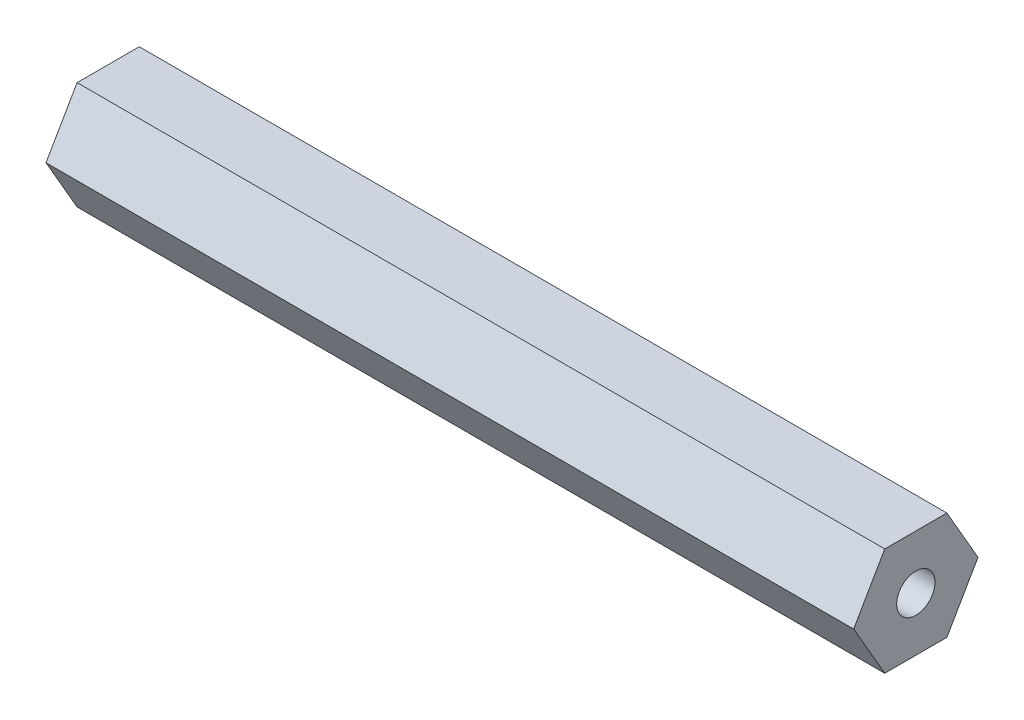
from build123d import *

# Parameters (mm, degrees)
EXTRUDE1_DEPTH            = 47.625
F_4_40_TAPPED_HOLE1_D     = 2.2606
F_4_40_TAPPED_HOLE1_DEPTH = 8.8646
F_4_40_TAPPED_HOLE1_TIP   = 0.679152758
F_4_40_TAPPED_HOLE2_D     = 2.2606
F_4_40_TAPPED_HOLE2_DEPTH = 8.8646
F_4_40_TAPPED_HOLE2_TIP   = 0.679152758


with BuildPart() as part:
    # Sketch1 → Extrude1 (new body)
    with BuildSketch(Plane(origin=(0, 0, 0), x_dir=(0, 0, -1), z_dir=(1, 0, 0))):
        Polygon((3.666174209, 0), (1.833087105, 3.175), (-1.833087105, 3.175), (-3.666174209, 0), (-1.833087105, -3.175), (1.833087105, -3.175), align=None)
    extrude(amount=-EXTRUDE1_DEPTH)

    # #4-40 Tapped Hole1
    with Locations(Plane(origin=(0, 0, 0), x_dir=(0, 0, -1), z_dir=(1, 0, 0))):
        with Locations((0, 0)):
            Hole(F_4_40_TAPPED_HOLE1_D / 2, depth=F_4_40_TAPPED_HOLE1_DEPTH)
            with Locations((0, 0, -(F_4_40_TAPPED_HOLE1_DEPTH + F_4_40_TAPPED_HOLE1_TIP / 2))):  # 118° drill point
                Cone(0, F_4_40_TAPPED_HOLE1_D / 2, F_4_40_TAPPED_HOLE1_TIP, mode=Mode.SUBTRACT)

    # #4-40 Tapped Hole2
    with Locations(Plane.ZY.offset(47.625)):
        with Locations((0, 0)):
            Hole(F_4_40_TAPPED_HOLE2_D / 2, depth=F_4_40_TAPPED_HOLE2_DEPTH)
            with Locations((0, 0, -(F_4_40_TAPPED_HOLE2_DEPTH + F_4_40_TAPPED_HOLE2_TIP / 2))):  # 118° drill point
                Cone(0, F_4_40_TAPPED_HOLE2_D / 2, F_4_40_TAPPED_HOLE2_TIP, mode=Mode.SUBTRACT)


solid = part.part
